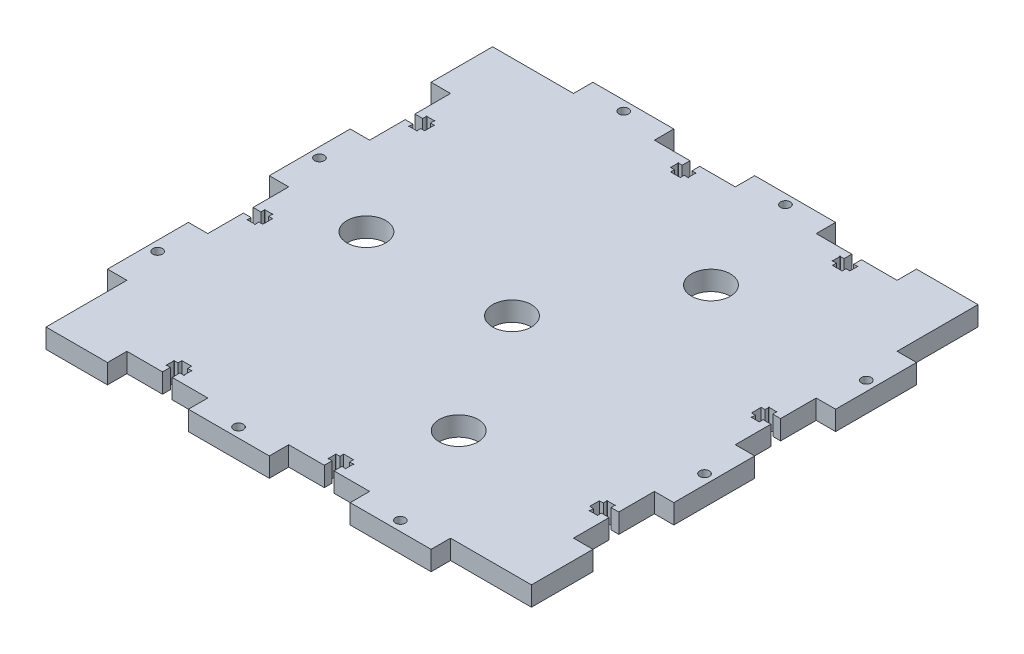
from build123d import *

# Parameters (mm, degrees)
BOSS_EXTRUDE1_DEPTH = 6
SKETCH2_R           = 1.5
CUT_EXTRUDE1_DEPTH  = 107.235587258
SKETCH3_R           = 6
CUT_EXTRUDE2_DEPTH  = 107.235587258
CIRPATTERN1_COUNT   = 3


with BuildPart() as part:
    # Sketch1 → Boss-Extrude1 (new body)
    with BuildSketch(Plane(origin=(0, 0, 0), x_dir=(1, 0, 0), z_dir=(0, 1, 0))):
        Polygon((0, 75), (25, 75), (25, 69), (50, 69), (50, 75), (69, 75), (69, 50), (75, 50), (75, 25), (69, 25), (69, 0), (75, 0), (75, -25), (69, -25), (69, -50), (75, -50), (75, -69), (50, -69), (50, -75), (25, -75), (25, -69), (0, -69), (0, -75), (-25, -75), (-25, -69), (-50, -69), (-50, -75), (-69, -75), (-69, -50), (-75, -50), (-75, -25), (-69, -25), (-69, 0), (-75, 0), (-75, 25), (-69, 25), (-69, 50), (-75, 50), (-75, 69), (-50, 69), (-50, 75), (-25, 75), (-25, 69), (0, 69), align=None)
    extrude(amount=BOSS_EXTRUDE1_DEPTH)

    # Sketch2 → Cut-Extrude1 (cut, through all)
    with BuildSketch(Plane(origin=(0, 6, 0), x_dir=(1, 0, 0), z_dir=(0, 1, 0))):
        with Locations(Location((-37.5, 72, 0), (0, 0, 270))):
            Circle(SKETCH2_R)
        with Locations(Location((12.5, 72, 0), (0, 0, 270))):
            Circle(SKETCH2_R)
        with Locations(Location((72, 37.5, 0), (0, 0, 270))):
            Circle(SKETCH2_R)
        with Locations(Location((72, -12.5, 0), (0, 0, 270))):
            Circle(SKETCH2_R)
        with Locations(Location((37.5, -72, 0), (0, 0, 270))):
            Circle(SKETCH2_R)
        with Locations(Location((-12.5, -72, 0), (0, 0, 270))):
            Circle(SKETCH2_R)
        with Locations(Location((-72, -37.5, 0), (0, 0, 270))):
            Circle(SKETCH2_R)
        with Locations(Location((-72, 12.5, 0), (0, 0, 270))):
            Circle(SKETCH2_R)
        with BuildLine():
            Line((-11, 69), (-14, 69))
            Line((-14, 69), (-14, 66.6))
            Line((-14, 66.6), (-15.1, 66.6))
            ThreePointArc((-15.1, 66.6), (-15.270710678, 66.670710678), (-15.2, 66.5))
            Line((-15.2, 66.5), (-15.2, 64.3))
            ThreePointArc((-15.2, 64.3), (-15.270710678, 64.129289322), (-15.1, 64.2))
            Line((-15.1, 64.2), (-14, 64.2))
            Line((-14, 64.2), (-14, 63))
            Line((-14, 63), (-11, 63))
            Line((-11, 63), (-11, 64.2))
            Line((-11, 64.2), (-9.9, 64.2))
            ThreePointArc((-9.9, 64.2), (-9.729289322, 64.129289322), (-9.8, 64.3))
            Line((-9.8, 64.3), (-9.8, 66.5))
            ThreePointArc((-9.8, 66.5), (-9.729289322, 66.670710678), (-9.9, 66.6))
            Line((-9.9, 66.6), (-11, 66.6))
            Line((-11, 66.6), (-11, 69))
        make_face()
        with BuildLine():
            Line((69, 11), (69, 14))
            Line((69, 14), (66.6, 14))
            Line((66.6, 14), (66.6, 15.1))
            ThreePointArc((66.6, 15.1), (66.670710678, 15.270710678), (66.5, 15.2))
            Line((66.5, 15.2), (64.3, 15.2))
            ThreePointArc((64.3, 15.2), (64.129289322, 15.270710678), (64.2, 15.1))
            Line((64.2, 15.1), (64.2, 14))
            Line((64.2, 14), (63, 14))
            Line((63, 14), (63, 11))
            Line((63, 11), (64.2, 11))
            Line((64.2, 11), (64.2, 9.9))
            ThreePointArc((64.2, 9.9), (64.129289322, 9.729289322), (64.3, 9.8))
            Line((64.3, 9.8), (66.5, 9.8))
            ThreePointArc((66.5, 9.8), (66.670710678, 9.729289322), (66.6, 9.9))
            Line((66.6, 9.9), (66.6, 11))
            Line((66.6, 11), (69, 11))
        make_face()
        with BuildLine():
            Line((39, 69), (36, 69))
            Line((36, 69), (36, 66.6))
            Line((36, 66.6), (34.9, 66.6))
            ThreePointArc((34.9, 66.6), (34.729289322, 66.670710678), (34.8, 66.5))
            Line((34.8, 66.5), (34.8, 64.3))
            ThreePointArc((34.8, 64.3), (34.729289322, 64.129289322), (34.9, 64.2))
            Line((34.9, 64.2), (36, 64.2))
            Line((36, 64.2), (36, 63))
            Line((36, 63), (39, 63))
            Line((39, 63), (39, 64.2))
            Line((39, 64.2), (40.1, 64.2))
            ThreePointArc((40.1, 64.2), (40.270710678, 64.129289322), (40.2, 64.3))
            Line((40.2, 64.3), (40.2, 66.5))
            ThreePointArc((40.2, 66.5), (40.270710678, 66.670710678), (40.1, 66.6))
            Line((40.1, 66.6), (39, 66.6))
            Line((39, 66.6), (39, 69))
        make_face()
        with BuildLine():
            Line((69, -39), (69, -36))
            Line((69, -36), (66.6, -36))
            Line((66.6, -36), (66.6, -34.9))
            ThreePointArc((66.6, -34.9), (66.670710678, -34.729289322), (66.5, -34.8))
            Line((66.5, -34.8), (64.3, -34.8))
            ThreePointArc((64.3, -34.8), (64.129289322, -34.729289322), (64.2, -34.9))
            Line((64.2, -34.9), (64.2, -36))
            Line((64.2, -36), (63, -36))
            Line((63, -36), (63, -39))
            Line((63, -39), (64.2, -39))
            Line((64.2, -39), (64.2, -40.1))
            ThreePointArc((64.2, -40.1), (64.129289322, -40.270710678), (64.3, -40.2))
            Line((64.3, -40.2), (66.5, -40.2))
            ThreePointArc((66.5, -40.2), (66.670710678, -40.270710678), (66.6, -40.1))
            Line((66.6, -40.1), (66.6, -39))
            Line((66.6, -39), (69, -39))
        make_face()
        with BuildLine():
            Line((11, -69), (14, -69))
            Line((14, -69), (14, -66.6))
            Line((14, -66.6), (15.1, -66.6))
            ThreePointArc((15.1, -66.6), (15.270710678, -66.670710678), (15.2, -66.5))
            Line((15.2, -66.5), (15.2, -64.3))
            ThreePointArc((15.2, -64.3), (15.270710678, -64.129289322), (15.1, -64.2))
            Line((15.1, -64.2), (14, -64.2))
            Line((14, -64.2), (14, -63))
            Line((14, -63), (11, -63))
            Line((11, -63), (11, -64.2))
            Line((11, -64.2), (9.9, -64.2))
            ThreePointArc((9.9, -64.2), (9.729289322, -64.129289322), (9.8, -64.3))
            Line((9.8, -64.3), (9.8, -66.5))
            ThreePointArc((9.8, -66.5), (9.729289322, -66.670710678), (9.9, -66.6))
            Line((9.9, -66.6), (11, -66.6))
            Line((11, -66.6), (11, -69))
        make_face()
        with BuildLine():
            Line((-39, -69), (-36, -69))
            Line((-36, -69), (-36, -66.6))
            Line((-36, -66.6), (-34.9, -66.6))
            ThreePointArc((-34.9, -66.6), (-34.729289322, -66.670710678), (-34.8, -66.5))
            Line((-34.8, -66.5), (-34.8, -64.3))
            ThreePointArc((-34.8, -64.3), (-34.729289322, -64.129289322), (-34.9, -64.2))
            Line((-34.9, -64.2), (-36, -64.2))
            Line((-36, -64.2), (-36, -63))
            Line((-36, -63), (-39, -63))
            Line((-39, -63), (-39, -64.2))
            Line((-39, -64.2), (-40.1, -64.2))
            ThreePointArc((-40.1, -64.2), (-40.270710678, -64.129289322), (-40.2, -64.3))
            Line((-40.2, -64.3), (-40.2, -66.5))
            ThreePointArc((-40.2, -66.5), (-40.270710678, -66.670710678), (-40.1, -66.6))
            Line((-40.1, -66.6), (-39, -66.6))
            Line((-39, -66.6), (-39, -69))
        make_face()
        with BuildLine():
            Line((-69, 39), (-69, 36))
            Line((-69, 36), (-66.6, 36))
            Line((-66.6, 36), (-66.6, 34.9))
            ThreePointArc((-66.6, 34.9), (-66.670710678, 34.729289322), (-66.5, 34.8))
            Line((-66.5, 34.8), (-64.3, 34.8))
            ThreePointArc((-64.3, 34.8), (-64.129289322, 34.729289322), (-64.2, 34.9))
            Line((-64.2, 34.9), (-64.2, 36))
            Line((-64.2, 36), (-63, 36))
            Line((-63, 36), (-63, 39))
            Line((-63, 39), (-64.2, 39))
            Line((-64.2, 39), (-64.2, 40.1))
            ThreePointArc((-64.2, 40.1), (-64.129289322, 40.270710678), (-64.3, 40.2))
            Line((-64.3, 40.2), (-66.5, 40.2))
            ThreePointArc((-66.5, 40.2), (-66.670710678, 40.270710678), (-66.6, 40.1))
            Line((-66.6, 40.1), (-66.6, 39))
            Line((-66.6, 39), (-69, 39))
        make_face()
        with BuildLine():
            Line((-69, -11), (-69, -14))
            Line((-69, -14), (-66.6, -14))
            Line((-66.6, -14), (-66.6, -15.1))
            ThreePointArc((-66.6, -15.1), (-66.670710678, -15.270710678), (-66.5, -15.2))
            Line((-66.5, -15.2), (-64.3, -15.2))
            ThreePointArc((-64.3, -15.2), (-64.129289322, -15.270710678), (-64.2, -15.1))
            Line((-64.2, -15.1), (-64.2, -14))
            Line((-64.2, -14), (-63, -14))
            Line((-63, -14), (-63, -11))
            Line((-63, -11), (-64.2, -11))
            Line((-64.2, -11), (-64.2, -9.9))
            ThreePointArc((-64.2, -9.9), (-64.129289322, -9.729289322), (-64.3, -9.8))
            Line((-64.3, -9.8), (-66.5, -9.8))
            ThreePointArc((-66.5, -9.8), (-66.670710678, -9.729289322), (-66.6, -9.9))
            Line((-66.6, -9.9), (-66.6, -11))
            Line((-66.6, -11), (-69, -11))
        make_face()
    extrude(amount=-CUT_EXTRUDE1_DEPTH, mode=Mode.SUBTRACT)

    # Sketch3 → Cut-Extrude2 (cut, through all)
    with BuildSketch(Plane.XZ):
        with Locations(Location((0, 0, 0), (0, 0, 270))):
            Circle(SKETCH3_R)
        with Locations(Location((-45, 0, 0), (0, 0, 270))):
            Circle(SKETCH3_R)
    cut_extrude2 = extrude(amount=-CUT_EXTRUDE2_DEPTH, mode=Mode.SUBTRACT)

    # CirPattern1: Cut-Extrude2 ×3 about axis
    cirpattern1_axis = Axis((0, 0, 0), (0, 1, 0))
    for i in range(1, CIRPATTERN1_COUNT):
        add(cut_extrude2.rotate(cirpattern1_axis, i * 360 / CIRPATTERN1_COUNT), mode=Mode.SUBTRACT)


solid = part.part
